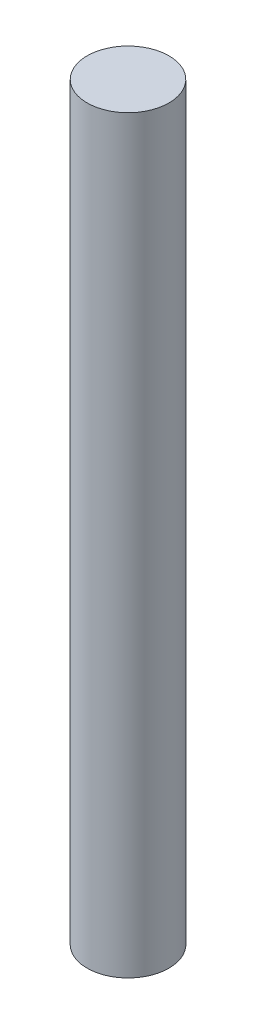
from build123d import *


with BuildPart() as part:
    # Sketch1 → Revolve1 (revolve)
    with BuildSketch(Plane.XY, mode=Mode.PRIVATE) as revolve1_sk:
        Polygon((0, 0), (-3, 0), (-3, -27), (-3, -28.271829467), (-3, -55), (0, -55), align=None)
    revolve(revolve1_sk.sketch.rotate(Axis((0, -55, 0), (0, 1, 0)), 180), axis=Axis((0, -55, 0), (0, 1, 0)))


solid = part.part
